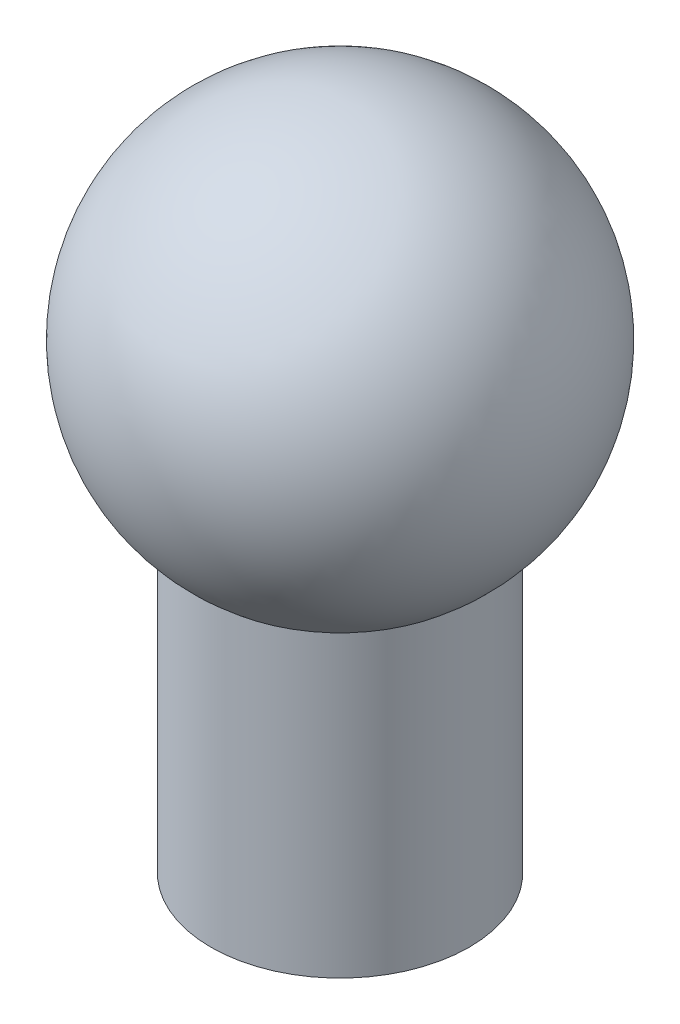
from build123d import *

# Parameters (mm, degrees)
SKETCH_1_R      = 2.8
EXTRUDE_1_DEPTH = 10


with BuildPart() as part:
    # 草图1 → 凸台-拉伸1 (new body)
    with BuildSketch(Plane(origin=(0, 0, 0), x_dir=(1, 0, 0), z_dir=(0, 1, 0))):
        with Locations(Location((0, 0, 0), (0, 0, 270))):
            Circle(SKETCH_1_R)
    extrude(amount=EXTRUDE_1_DEPTH)

    # 草图2 → 旋转1 (revolve)
    with BuildSketch(Plane(origin=(0, 10, 0), x_dir=(1, 0, 0), z_dir=(0, 1, 0))):
        with BuildLine():
            Line((0, 4.5), (0, -4.5))
            ThreePointArc((0, -4.5), (4.5, 0), (0, 4.5))
        make_face()
    revolve(axis=Axis((0, 10, -4.5), (0, 0, 1)))


solid = part.part
